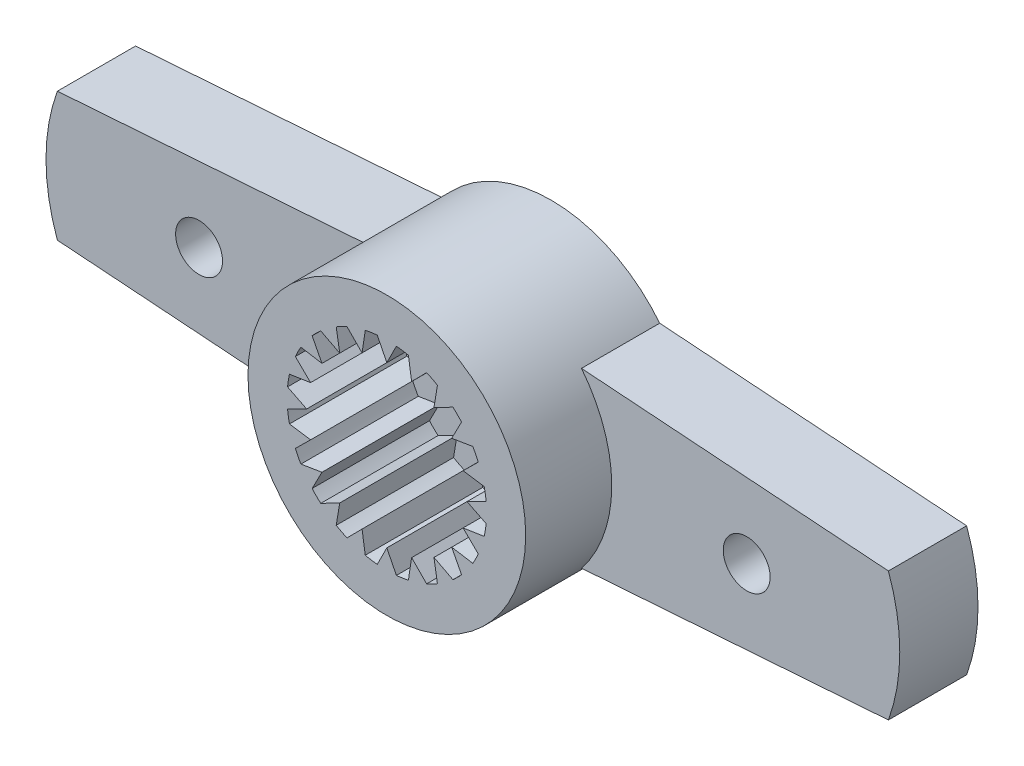
from build123d import *

# Parameters (mm, degrees)
SKETCH2_R           = 3.55
BOSS_EXTRUDE1_DEPTH = 4.2
BOSS_EXTRUDE2_DEPTH = 2
SKETCH5_R           = 2.549999919
CUT_EXTRUDE1_DEPTH  = 3
BOSS_EXTRUDE3_DEPTH = 3
SKETCH6_R           = 1.4
CUT_EXTRUDE2_DEPTH  = 12.862042223
SKETCH7_R           = 0.6
CUT_EXTRUDE3_DEPTH  = 12.685377431


with BuildPart() as part:
    # Sketch2 → Boss-Extrude1 (new body)
    with BuildSketch(Plane.XY):
        Circle(SKETCH2_R)
    extrude(amount=-BOSS_EXTRUDE1_DEPTH)

    # Sketch4 → Boss-Extrude2 (add)
    with BuildSketch(Plane.XY.offset(-2.2)):
        with BuildLine():
            Line((2.776387215, 2.212277889), (10.622617722, 1.649999976))
            ThreePointArc((10.622617722, 1.649999976), (10.913548722, 0), (10.622617722, -1.649999976))
            Line((10.622617722, -1.649999976), (2.776387215, -2.212277889))
            ThreePointArc((2.776387215, -2.212277889), (3.549999952, 0), (2.776387215, 2.212277889))
        make_face()
    boss_extrude2 = extrude(amount=-BOSS_EXTRUDE2_DEPTH)

    # Sketch5 → Cut-Extrude1 (cut)
    with BuildSketch(Plane.XY):
        Circle(SKETCH5_R)
    extrude(amount=-CUT_EXTRUDE1_DEPTH, mode=Mode.SUBTRACT)

    # Sketch3 → Boss-Extrude3 (add)
    with BuildSketch(Plane.XY):
        with BuildLine():
            Line((-0.244697916, 2.538232164), (0, 2.049999952))
            Line((0, 2.049999952), (0.244697916, 2.538232164))
            ThreePointArc((0.244697916, 2.538232164), (0, 2.549999919), (-0.244697916, 2.538232164))
        make_face()
        with BuildLine():
            Line((0.551635326, 2.489618054), (0.633484824, 1.949665813))
            Line((0.633484824, 1.949665813), (1.017078422, 2.338386424))
            ThreePointArc((1.017078422, 2.338386424), (0.787993311, 2.42519404), (0.551635326, 2.489618054))
        make_face()
        with BuildLine():
            Line((1.29397066, 2.197302783), (1.204959739, 1.6584848))
            Line((1.204959739, 1.6584848), (1.689900206, 1.90964313))
            ThreePointArc((1.689900206, 1.90964313), (1.498852346, 2.06299327), (1.29397066, 2.197302783))
        make_face()
        with BuildLine():
            Line((1.90964313, 1.689900206), (1.6584848, 1.204959739))
            Line((1.6584848, 1.204959739), (2.197302783, 1.29397066))
            ThreePointArc((2.197302783, 1.29397066), (2.06299327, 1.498852346), (1.90964313, 1.689900206))
        make_face()
        with BuildLine():
            Line((2.338386424, 1.017078422), (1.949665813, 0.633484824))
            Line((1.949665813, 0.633484824), (2.489618054, 0.551635326))
            ThreePointArc((2.489618054, 0.551635326), (2.42519404, 0.787993311), (2.338386424, 1.017078422))
        make_face()
        with BuildLine():
            Line((2.538232164, 0.244697916), (2.049999952, 0))
            Line((2.049999952, 0), (2.538232164, -0.244697916))
            ThreePointArc((2.538232164, -0.244697916), (2.549999919, 0), (2.538232164, 0.244697916))
        make_face()
        with BuildLine():
            Line((2.489618054, -0.551635326), (1.949665813, -0.633484824))
            Line((1.949665813, -0.633484824), (2.338386424, -1.017078422))
            ThreePointArc((2.338386424, -1.017078422), (2.42519404, -0.787993311), (2.489618054, -0.551635326))
        make_face()
        with BuildLine():
            Line((2.197302783, -1.29397066), (1.6584848, -1.204959739))
            Line((1.6584848, -1.204959739), (1.90964313, -1.689900206))
            ThreePointArc((1.90964313, -1.689900206), (2.06299327, -1.498852346), (2.197302783, -1.29397066))
        make_face()
        with BuildLine():
            Line((1.689900206, -1.90964313), (1.204959739, -1.6584848))
            Line((1.204959739, -1.6584848), (1.29397066, -2.197302783))
            ThreePointArc((1.29397066, -2.197302783), (1.498852346, -2.06299327), (1.689900206, -1.90964313))
        make_face()
        with BuildLine():
            Line((1.017078422, -2.338386424), (0.633484824, -1.949665813))
            Line((0.633484824, -1.949665813), (0.551635326, -2.489618054))
            ThreePointArc((0.551635326, -2.489618054), (0.787993311, -2.42519404), (1.017078422, -2.338386424))
        make_face()
        with BuildLine():
            Line((0.244697916, -2.538232164), (0, -2.049999952))
            Line((0, -2.049999952), (-0.244697916, -2.538232164))
            ThreePointArc((-0.244697916, -2.538232164), (0, -2.549999919), (0.244697916, -2.538232164))
        make_face()
        with BuildLine():
            Line((-0.551635326, -2.489618054), (-0.633484824, -1.949665813))
            Line((-0.633484824, -1.949665813), (-1.017078422, -2.338386424))
            ThreePointArc((-1.017078422, -2.338386424), (-0.787993311, -2.42519404), (-0.551635326, -2.489618054))
        make_face()
        with BuildLine():
            Line((-1.29397066, -2.197302783), (-1.204959739, -1.6584848))
            Line((-1.204959739, -1.6584848), (-1.689900206, -1.90964313))
            ThreePointArc((-1.689900206, -1.90964313), (-1.498852346, -2.06299327), (-1.29397066, -2.197302783))
        make_face()
        with BuildLine():
            Line((-1.90964313, -1.689900206), (-1.6584848, -1.204959739))
            Line((-1.6584848, -1.204959739), (-2.197302783, -1.29397066))
            ThreePointArc((-2.197302783, -1.29397066), (-2.06299327, -1.498852346), (-1.90964313, -1.689900206))
        make_face()
        with BuildLine():
            Line((-2.338386424, -1.017078422), (-1.949665813, -0.633484824))
            Line((-1.949665813, -0.633484824), (-2.489618054, -0.551635326))
            ThreePointArc((-2.489618054, -0.551635326), (-2.42519404, -0.787993311), (-2.338386424, -1.017078422))
        make_face()
        with BuildLine():
            Line((-2.538232164, -0.244697916), (-2.049999952, 0))
            Line((-2.049999952, 0), (-2.538232164, 0.244697916))
            ThreePointArc((-2.538232164, 0.244697916), (-2.549999919, 0), (-2.538232164, -0.244697916))
        make_face()
        with BuildLine():
            Line((-2.489618054, 0.551635326), (-1.949665813, 0.633484824))
            Line((-1.949665813, 0.633484824), (-2.338386424, 1.017078422))
            ThreePointArc((-2.338386424, 1.017078422), (-2.42519404, 0.787993311), (-2.489618054, 0.551635326))
        make_face()
        with BuildLine():
            Line((-2.197302783, 1.29397066), (-1.6584848, 1.204959739))
            Line((-1.6584848, 1.204959739), (-1.90964313, 1.689900206))
            ThreePointArc((-1.90964313, 1.689900206), (-2.06299327, 1.498852346), (-2.197302783, 1.29397066))
        make_face()
        with BuildLine():
            Line((-1.689900206, 1.90964313), (-1.204959739, 1.6584848))
            Line((-1.204959739, 1.6584848), (-1.29397066, 2.197302783))
            ThreePointArc((-1.29397066, 2.197302783), (-1.498852346, 2.06299327), (-1.689900206, 1.90964313))
        make_face()
        with BuildLine():
            Line((-1.017078422, 2.338386424), (-0.633484824, 1.949665813))
            Line((-0.633484824, 1.949665813), (-0.551635326, 2.489618054))
            ThreePointArc((-0.551635326, 2.489618054), (-0.787993311, 2.42519404), (-1.017078422, 2.338386424))
        make_face()
    extrude(amount=-BOSS_EXTRUDE3_DEPTH)

    # Sketch6 → Cut-Extrude2 (cut, through all)
    with BuildSketch(Plane.XY.offset(-3)):
        Circle(SKETCH6_R)
    extrude(amount=-CUT_EXTRUDE2_DEPTH, mode=Mode.SUBTRACT)

    # Sketch7 → Cut-Extrude3 (cut, through all)
    with BuildSketch(Plane.XY.offset(-2.2)):
        with Locations((7, 0)):
            Circle(SKETCH7_R)
    cut_extrude3 = extrude(amount=-CUT_EXTRUDE3_DEPTH, mode=Mode.SUBTRACT)

    # Mirror1: Boss-Extrude2 across plane
    add(boss_extrude2.mirror(Plane(origin=(0, 0, 0), x_dir=(0, 0, 1), z_dir=(1, 0, 0))))

    # Mirror2: Cut-Extrude3 across plane
    add(cut_extrude3.mirror(Plane(origin=(0, 0, 0), x_dir=(0, 0, 1), z_dir=(1, 0, 0))), mode=Mode.SUBTRACT)


solid = part.part
